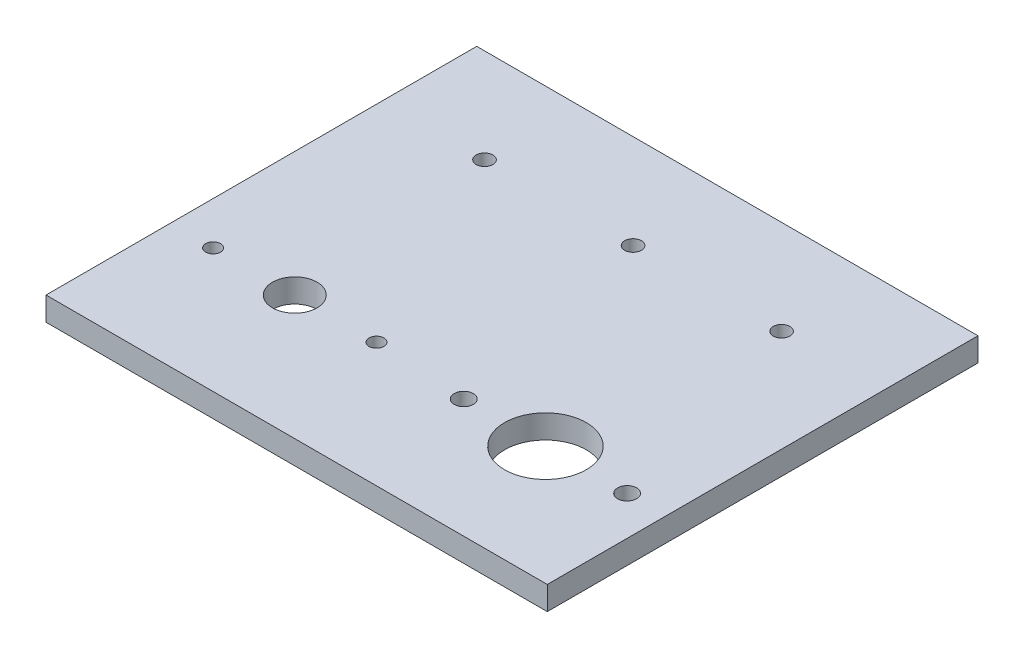
from build123d import *

# Parameters (mm, degrees)
SKETCH1_W               = 65
SKETCH1_H               = 116
SKETCH1_W_2             = 70
BOSS_EXTRUDE1_DEPTH     = 6.35
F_10_CLEARANCE_HOLE1_D  = 5.1054
SKETCH9_R               = 11
CUT_EXTRUDE2_DEPTH      = 118.94309009
M4_CLEARANCE_HOLE1_D    = 4.5
CUT_EXTRUDE3_DEPTH      = 118.94309009
CUT_EXTRUDE3_DEPTH_BACK = 118.94309009
SKETCH12_R              = 6
SKETCH12_R_2            = 2


with BuildPart() as part:
    # Sketch1 → Boss-Extrude1 (new body)
    with BuildSketch(Plane(origin=(0, 0, 0), x_dir=(1, 0, 0), z_dir=(0, 1, 0))):
        Rectangle(SKETCH1_W, SKETCH1_H)
        with Locations((-67.5, 0)):
            Rectangle(SKETCH1_W_2, SKETCH1_H)
    extrude(amount=BOSS_EXTRUDE1_DEPTH)

    # #10 Clearance Hole1 (through all)
    with Locations(Plane(origin=(0, 6.35, 0), x_dir=(1, 0, 0), z_dir=(0, 1, 0))):
        with Locations((-22, -25.996), (22, -25.996)):
            Hole(F_10_CLEARANCE_HOLE1_D / 2)

    # Sketch9 → Cut-Extrude2 (cut, through all)
    with BuildSketch(Plane(origin=(0, 6.35, 0), x_dir=(1, 0, 0), z_dir=(0, 1, 0))):
        with Locations(Location((0, -25.996, 0), (0, 0, 270))):
            Circle(SKETCH9_R)
    extrude(amount=-CUT_EXTRUDE2_DEPTH, mode=Mode.SUBTRACT)

    # M4 Clearance Hole1 (through all)
    with Locations(Plane(origin=(0, 6.35, 0), x_dir=(1, 0, 0), z_dir=(0, 1, 0))):
        with Locations((-75, 32.6), (-35, 32.6), (5, 32.6)):
            Hole(M4_CLEARANCE_HOLE1_D / 2)

    # Sketch12 → Cut-Extrude3 (cut, two sides: drawn at the far end of the back side and taken through both)
    with BuildSketch(Plane(origin=(0, 6.35, 0), x_dir=(1, 0, 0), z_dir=(0, 1, 0)).offset(-CUT_EXTRUDE3_DEPTH_BACK)):
        with Locations(Location((-69, -24.5, 0), (0, 0, 270))):
            Circle(SKETCH12_R)
        with Locations(Location((-91, -24.5, 0), (0, 0, 270))):
            Circle(SKETCH12_R_2)
        with Locations(Location((-47, -24.5, 0), (0, 0, 270))):
            Circle(SKETCH12_R_2)
    extrude(amount=CUT_EXTRUDE3_DEPTH + CUT_EXTRUDE3_DEPTH_BACK, mode=Mode.SUBTRACT)


solid = part.part
